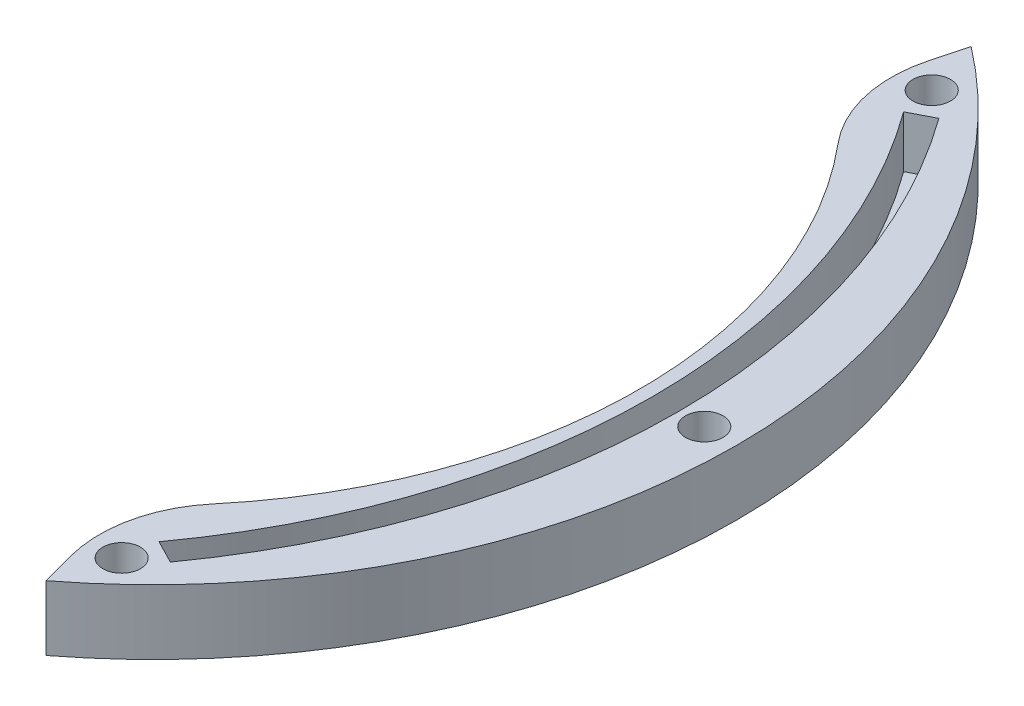
from build123d import *

# Parameters (mm, degrees)
EXTRUDE_1_DEPTH     = 5
SKETCH_2_R          = 1.45
CUT_EXTRUDE_1_DEPTH = 5
CUT_EXTRUDE_2_DEPTH = 4
FILLET_1_R          = 10


with BuildPart() as part:
    # Эскиз1 → Бобышка-Вытянуть1 (new body)
    with BuildSketch(Plane(origin=(0, 0, 0), x_dir=(1, 0, 0), z_dir=(0, 1, 0))):
        with BuildLine():
            Line((25.256912811, 27.718916921), (27.395437576, 35.7))
            ThreePointArc((27.395437576, 35.7), (45, 0), (27.395437576, -35.7))
            Line((27.395437576, -35.7), (25.256912811, -27.718916921))
            ThreePointArc((25.256912811, -27.718916921), (37.5, 0), (25.256912811, 27.718916921))
        make_face()
    extrude(amount=EXTRUDE_1_DEPTH)

    # Эскиз2 → Вырез-Вытянуть1 (cut)
    with BuildSketch(Plane(origin=(0, 5, 0), x_dir=(1, 0, 0), z_dir=(0, 1, 0))):
        with Locations(Location((42.5, 0, 0), (0, 0, 270))):
            Circle(SKETCH_2_R)
        with Locations(Location((28.793836633, 31.259638065, 0), (0, 0, 270))):
            Circle(SKETCH_2_R)
        with Locations(Location((28.793836633, -31.259638065, 0), (0, 0, 90))):
            Circle(SKETCH_2_R)
    extrude(amount=-CUT_EXTRUDE_1_DEPTH, mode=Mode.SUBTRACT)

    # Эскиз3 → Вырез-Вытянуть2 (cut)
    with BuildSketch(Plane(origin=(0, 5, 0), x_dir=(1, 0, 0), z_dir=(0, 1, 0))):
        with BuildLine():
            Line((29.152397919, 28.734107513), (30.952735107, 29.657502375))
            ThreePointArc((30.952735107, 29.657502375), (40.5, -1.12e-07), (30.952736281, -29.657502977))
            Line((30.952736281, -29.657502977), (29.152399104, -28.734108121))
            ThreePointArc((29.152399104, -28.734108121), (38.5, -1.11e-07), (29.152397919, 28.734107513))
        make_face()
    extrude(amount=-CUT_EXTRUDE_2_DEPTH, mode=Mode.SUBTRACT)

    # Скругление1
    fillet_1_edges = [part.edges().sort_by_distance(p)[0] for p in [
        (25.256912811, 2.5, 27.718916921),
        (25.256912811, 2.5, -27.718916921),
    ]]
    fillet(fillet_1_edges, radius=FILLET_1_R)


solid = part.part
